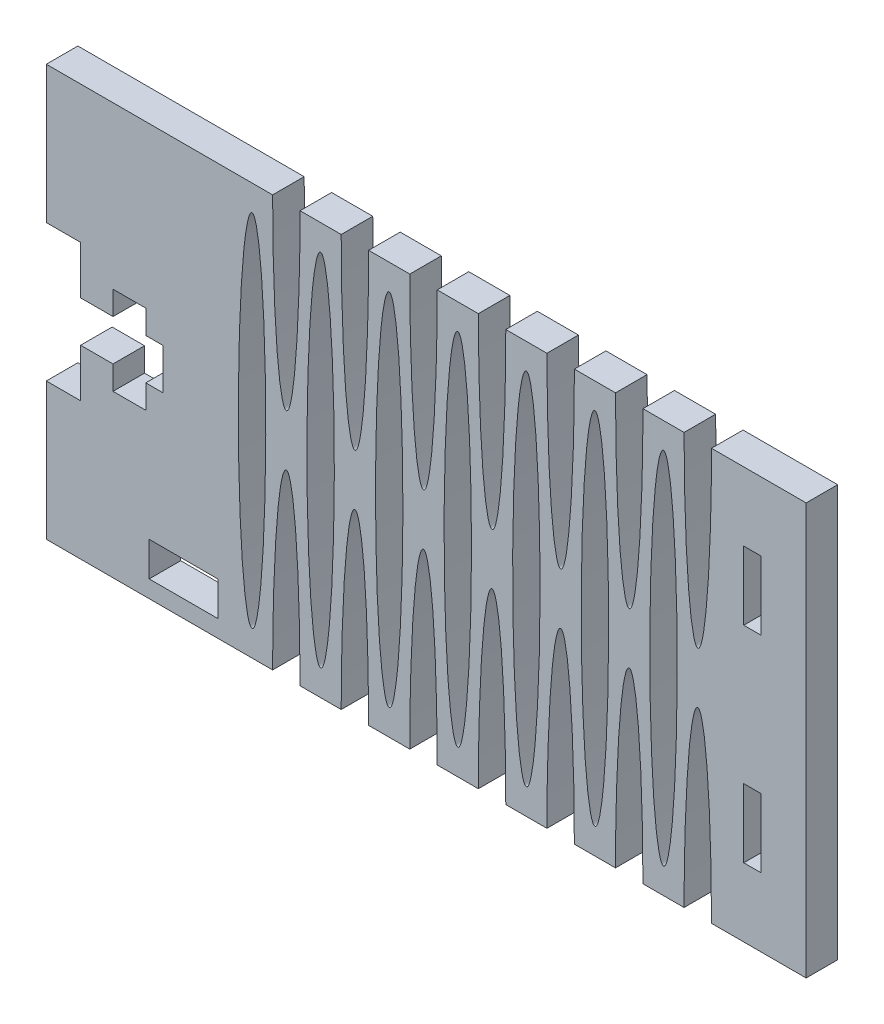
from build123d import *

# Parameters (mm, degrees)
SKETCH1_W           = 70.358
SKETCH1_H           = 38.1
BOSS_EXTRUDE1_DEPTH = 2.921
SKETCH2_W           = 3.175
SKETCH2_H           = 12.7
SKETCH2_W_2         = 6.35
SKETCH2_H_2         = 3.175
CUT_EXTRUDE1_DEPTH  = 80.321769151
CUT_EXTRUDE2_DEPTH  = 80.321769151
CUT_EXTRUDE3_DEPTH  = 80.321769151
LPATTERN1_COUNT     = 7
LPATTERN1_PITCH     = 6.35
SKETCH5_W           = 1.5875
SKETCH5_H           = 6.35
CUT_EXTRUDE4_DEPTH  = 80.321769289


with BuildPart() as part:
    # Sketch1 → Boss-Extrude1 (new body)
    with BuildSketch(Plane(origin=(0, 0, -35.179), x_dir=(-1, 0, 0), z_dir=(0, 0, -1))):
        with Locations((-35.179, 17.4625)):
            Rectangle(SKETCH1_W, SKETCH1_H)
    extrude(amount=BOSS_EXTRUDE1_DEPTH)

    # Sketch2 → Cut-Extrude1 (cut, through all)
    with BuildSketch(Plane(origin=(0, 0, -38.1), x_dir=(-1, 0, 0), z_dir=(0, 0, -1))):
        with Locations((-1.5875, 17.4625)):
            Rectangle(SKETCH2_W, SKETCH2_H)
        with Locations((-12.7, 1.5875)):
            Rectangle(SKETCH2_W_2, SKETCH2_H_2)
    extrude(amount=-CUT_EXTRUDE1_DEPTH, mode=Mode.SUBTRACT)

    # Sketch3 → Cut-Extrude2 (cut, through all)
    with BuildSketch(Plane(origin=(0, 0, -38.1), x_dir=(-1, 0, 0), z_dir=(0, 0, -1))):
        Polygon((147.571601036, 19.36115), (-3.175, 19.36115), (-6.175375, 19.36115), (-6.175375, 21.55825), (-9.2075, 21.55825), (-9.2075, 19.36115), (-10.795, 19.36115), (-10.795, 15.56385), (-9.2075, 15.56385), (-9.2075, 13.36675), (-6.175375, 13.36675), (-6.175375, 15.56385), (-3.175, 15.56385), (147.571601036, 15.56385), (449.064803109, 15.56385), (449.064803109, 19.36115), align=None)
    extrude(amount=-CUT_EXTRUDE2_DEPTH, mode=Mode.SUBTRACT)

    # Sketch4 → Cut-Extrude3 (cut, through all)
    with BuildSketch(Plane.XY.offset(-35.179)):
        with BuildLine():
            add(Edge.make_bspline(
                [(19.05, 0.79375), (21.249704526, 0.79375), (20.149852263, 25.796875), (19.05, 50.8), (17.950147737, 25.796875), (16.850295474, 0.79375), (19.05, 0.79375)],
                knots=[0, 0, 0, 2.094395102, 2.094395102, 4.188790205, 4.188790205, 6.283185307, 6.283185307, 6.283185307], degree=2, weights=[1, 0.5, 1, 0.5, 1, 0.5, 1]))
        make_face()
        with BuildLine():
            add(Edge.make_bspline(
                [(23.495, -1.5875), (23.495, 15.08125), (22.225, 15.08125)],
                knots=[4.71238898, 4.71238898, 4.71238898, 6.283185307, 6.283185307, 6.283185307], degree=2, weights=[1, 0.707106781, 1]))
            add(Edge.make_bspline(
                [(22.225, 15.08125), (20.955, 15.08125), (20.955, -1.5875)],
                knots=[0, 0, 0, 1.570796327, 1.570796327, 1.570796327], degree=2, weights=[1, 0.707106781, 1]))
            add(Edge.make_bspline(
                [(20.955, -1.5875), (20.955, -18.25625), (22.225, -18.25625), (23.495, -18.25625), (23.495, -1.5875)],
                knots=[1.570796327, 1.570796327, 1.570796327, 3.141592654, 3.141592654, 4.71238898, 4.71238898, 4.71238898], degree=2, weights=[1, 0.707106781, 1, 0.707106781, 1]))
        make_face()
        with BuildLine():
            add(Edge.make_bspline(
                [(22.225, 19.84375), (24.424704526, 19.84375), (23.324852263, 44.846875), (22.225, 69.85), (21.125147737, 44.846875), (20.025295474, 19.84375), (22.225, 19.84375)],
                knots=[0, 0, 0, 2.094395102, 2.094395102, 4.188790205, 4.188790205, 6.283185307, 6.283185307, 6.283185307], degree=2, weights=[1, 0.5, 1, 0.5, 1, 0.5, 1]))
        make_face()
    cut_extrude3 = extrude(amount=-CUT_EXTRUDE3_DEPTH, mode=Mode.SUBTRACT)

    # LPattern1: Cut-Extrude3 ×7
    with Locations(*[(i * LPATTERN1_PITCH, 0, 0) for i in range(1, LPATTERN1_COUNT)]):
        add(cut_extrude3, mode=Mode.SUBTRACT)

    # Sketch5 → Cut-Extrude4 (cut, through all)
    with BuildSketch(Plane.XY.offset(-35.179)):
        with Locations((65.37325, 26.9875)):
            Rectangle(SKETCH5_W, SKETCH5_H)
        with Locations((65.37325, 7.9375)):
            Rectangle(SKETCH5_W, SKETCH5_H)
    extrude(amount=-CUT_EXTRUDE4_DEPTH, mode=Mode.SUBTRACT)


solid = part.part
